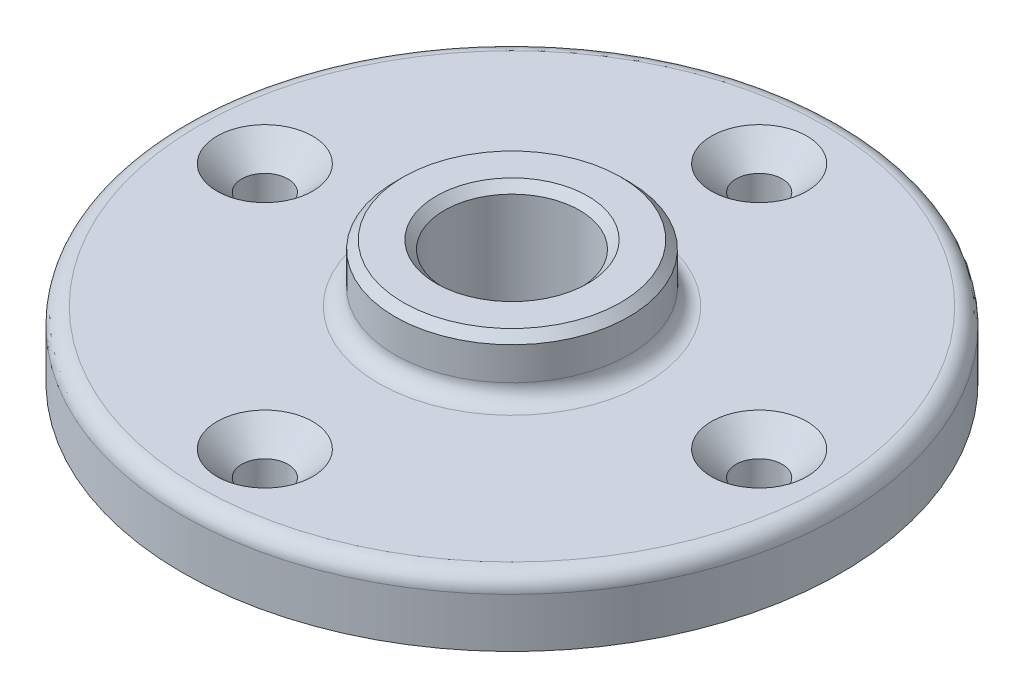
from build123d import *

# Parameters (mm, degrees)
SKETCH1_R                    = 20
BOSS_EXTRUDE1_DEPTH          = 4
SKETCH2_R                    = 4.1
CUT_EXTRUDE1_DEPTH           = 29.565713714
SKETCH3_R                    = 1.4
CUT_EXTRUDE2_DEPTH           = 29.565713714
CHAMFER1_SIZE                = 1.5
CIRPATTERN1_COUNT            = 4
CHAMFER1_OF_CIRPATTERN1_SIZE = 1.5
FILLET1_R                    = 1
BOSS_EXTRUDE2_START          = 3.5
SKETCH4_R                    = 7.1
SKETCH4_R_2                  = 4.1
BOSS_EXTRUDE2_DEPTH          = 3.5
CHAMFER2_SIZE                = 0.5
FILLET2_R                    = 1
CHAMFER3_SIZE                = 0.5


with BuildPart() as part:
    # Sketch1 → Boss-Extrude1 (new body)
    with BuildSketch(Plane(origin=(0, 0, 0), x_dir=(1, 0, 0), z_dir=(0, 1, 0))):
        Circle(SKETCH1_R)
    extrude(amount=BOSS_EXTRUDE1_DEPTH)

    # Sketch2 → Cut-Extrude1 (cut, through all)
    with BuildSketch(Plane(origin=(0, 4, 0), x_dir=(1, 0, 0), z_dir=(0, 1, 0))):
        Circle(SKETCH2_R)
    extrude(amount=-CUT_EXTRUDE1_DEPTH, mode=Mode.SUBTRACT)

    # Sketch3 → Cut-Extrude2 (cut, through all)
    with BuildSketch(Plane(origin=(0, 4, 0), x_dir=(1, 0, 0), z_dir=(0, 1, 0))):
        with Locations((0, 15)):
            Circle(SKETCH3_R)
    cut_extrude2 = extrude(amount=-CUT_EXTRUDE2_DEPTH, mode=Mode.SUBTRACT)

    # Chamfer1
    chamfer1_edges = [part.edges().sort_by_distance(p)[0] for p in [
        (-1.4, 4, -15),
    ]]
    chamfer(chamfer1_edges, length=CHAMFER1_SIZE)

    # CirPattern1: Cut-Extrude2 ×4 about axis
    cirpattern1_axis = Axis((0, 0, 0), (0, 1, 0))
    for i in range(1, CIRPATTERN1_COUNT):
        add(cut_extrude2.rotate(cirpattern1_axis, i * 360 / CIRPATTERN1_COUNT), mode=Mode.SUBTRACT)

    # Chamfer1 of CirPattern1
    chamfer1_of_cirpattern1_edges = [part.edges().sort_by_distance(p)[0] for p in [
        (-15, 4, 1.4),
        (1.4, 4, 15),
        (15, 4, -1.4),
    ]]
    chamfer(chamfer1_of_cirpattern1_edges, length=CHAMFER1_OF_CIRPATTERN1_SIZE)

    # Fillet1
    fillet1_edges = [part.edges().sort_by_distance(p)[0] for p in [
        (-20, 4, 0),
    ]]
    fillet(fillet1_edges, radius=FILLET1_R)

    # Sketch4 → Boss-Extrude2 (add)
    with BuildSketch(Plane(origin=(0, 4, 0), x_dir=(1, 0, 0), z_dir=(0, 1, 0)).offset(BOSS_EXTRUDE2_START)):
        Circle(SKETCH4_R)
        Circle(SKETCH4_R_2, mode=Mode.SUBTRACT)
    extrude(amount=-BOSS_EXTRUDE2_DEPTH)

    # Chamfer2
    chamfer2_edges = [part.edges().sort_by_distance(p)[0] for p in [
        (-4.1, 7.5, 0),
    ]]
    chamfer(chamfer2_edges, length=CHAMFER2_SIZE)

    # Fillet2
    fillet2_edges = [part.edges().sort_by_distance(p)[0] for p in [
        (-7.1, 4, 0),
    ]]
    fillet(fillet2_edges, radius=FILLET2_R)

    # Chamfer3
    chamfer3_edges = [part.edges().sort_by_distance(p)[0] for p in [
        (-7.1, 7.5, 0),
    ]]
    chamfer(chamfer3_edges, length=CHAMFER3_SIZE)


solid = part.part
